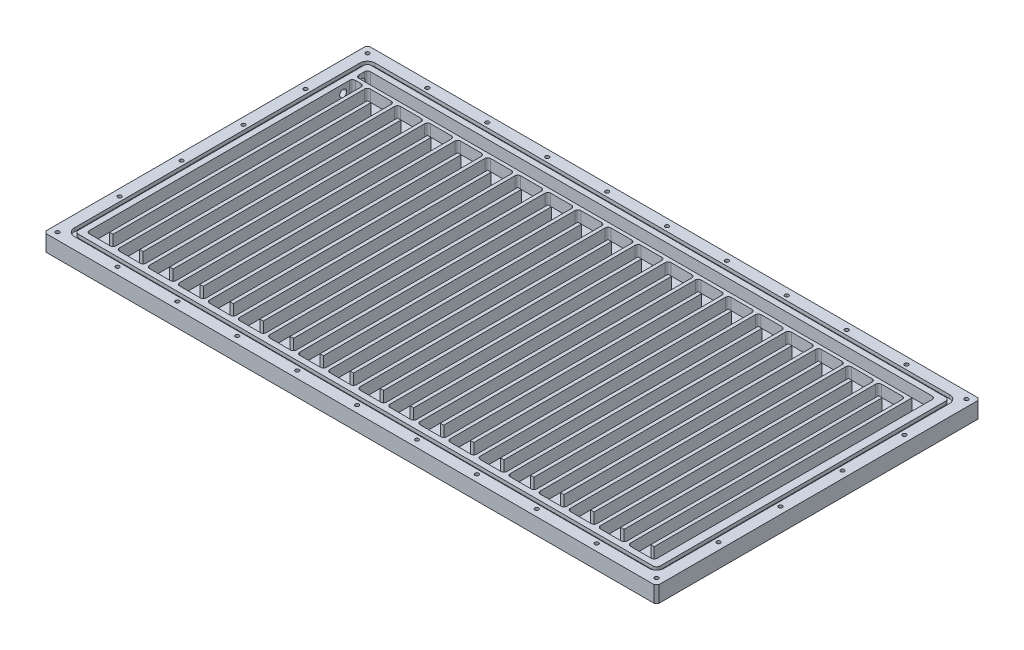
from build123d import *

# Parameters (mm, degrees)
SKETCH1_W             = 265
SKETCH1_H             = 140
BOSS_EXTRUDE1_DEPTH   = 14
CUT_EXTRUDE1_DEPTH    = 3
FILLET1_R             = 3
FILLET2_R             = 6.5
M4X0_7_TAPPED_HOLE1_D = 3.3
MIRROR4_COPY_1_D      = 3.3
SKETCH3_W             = 10
SKETCH3_H             = 230
CUT_EXTRUDE2_DEPTH    = 10
LPATTERN1_COUNT       = 38
LPATTERN1_PITCH       = 13
SKETCH4_W             = 3
SKETCH4_H             = 10
CUT_EXTRUDE3_DEPTH    = 10
LPATTERN2_COUNT       = 19
LPATTERN2_PITCH       = 26
SKETCH5_W             = 3
SKETCH5_H             = 10
CUT_EXTRUDE4_DEPTH    = 10
LPATTERN3_COUNT       = 18
LPATTERN3_PITCH       = 26
CUT_EXTRUDE5_DEPTH    = 10
FILLET3_R             = 2.5
FILLET4_R             = 2.5
CHAMFER1_SIZE         = 2
FILLET5_R             = 2.5
LPATTERN10_COUNT      = 2
LPATTERN10_PITCH      = 16


with BuildPart() as part:
    # Sketch1 → Boss-Extrude1 (new body)
    with BuildSketch(Plane(origin=(0, 0, 0), x_dir=(1, 0, 0), z_dir=(0, 1, 0))):
        with Locations((132.5, 70)):
            Rectangle(SKETCH1_W, SKETCH1_H)
    extrude(amount=BOSS_EXTRUDE1_DEPTH)

    # Sketch2 → Cut-Extrude1 (cut)
    with BuildSketch(Plane(origin=(0, 14, 0), x_dir=(1, 0, 0), z_dir=(0, 1, 0))):
        Polygon((10, 140), (13.5, 140), (13.5, 13.5), (265, 13.5), (265, 10), (14.894895508, 10), (10, 10), align=None)
    extrude(amount=-CUT_EXTRUDE1_DEPTH, mode=Mode.SUBTRACT)

    # Fillet1
    fillet1_edges = [part.edges().sort_by_distance(p)[0] for p in [
        (13.5, 12.5, -13.5),
    ]]
    fillet(fillet1_edges, radius=FILLET1_R)

    # Fillet2
    fillet2_edges = [part.edges().sort_by_distance(p)[0] for p in [
        (10, 12.5, -10),
    ]]
    fillet(fillet2_edges, radius=FILLET2_R)

    # Mirror1: part across plane


with BuildPart() as part_1:
    add(part.part)
    add(part.part.mirror(Plane(origin=(265, 14, 0), x_dir=(0, 0, 1), z_dir=(-1, 0, 0))))

    # Mirror2: part across plane


with BuildPart() as part_2:
    add(part_1.part)
    add(part_1.part.mirror(Plane(origin=(0, 14, -140), x_dir=(1, 0, 0), z_dir=(0, 0, 1))))

    # M4x0.7 Tapped Hole1 (through all)
    with Locations(Plane(origin=(6, 0, -113.2), x_dir=(0, 0, -1), z_dir=(0, -1, 0))):
        with Locations((0, 0), (-53.6, 0), (-107.2, 0), (-107.2, 51.8), (-107.2, 103.6), (-107.2, 155.4), (-107.2, 207.2), (-107.2, 259)):
            m4x0_7_tapped_hole1 = Hole(M4X0_7_TAPPED_HOLE1_D / 2)

    # Mirror3: M4x0.7 Tapped Hole1 across plane
    add(m4x0_7_tapped_hole1.mirror(Plane.XY.offset(-140)), mode=Mode.SUBTRACT)

    # Mirror4: M4x0.7 Tapped Hole1 across plane
    add(m4x0_7_tapped_hole1.mirror(Plane(origin=(265, 0, 0), x_dir=(0, 0, 1), z_dir=(1, 0, 0))), mode=Mode.SUBTRACT)

    # Mirror4 copy 1 (through all)
    with Locations(Plane(origin=(524, 0, -166.8), x_dir=(0, 0, 1), z_dir=(0, -1, 0))):
        with Locations((0, 0), (-53.6, 0), (-107.2, 0), (-107.2, 51.8), (-107.2, 103.6), (-107.2, 155.4), (-107.2, 207.2), (-107.2, 259)):
            Hole(MIRROR4_COPY_1_D / 2)

    # Sketch3 → Cut-Extrude2 (cut)
    with BuildSketch(Plane(origin=(0, 14, 0), x_dir=(1, 0, 0), z_dir=(0, 1, 0))):
        with Locations((23.5, 133.5)):
            Rectangle(SKETCH3_W, SKETCH3_H)
    cut_extrude2 = extrude(amount=-CUT_EXTRUDE2_DEPTH, mode=Mode.SUBTRACT)

    # LPattern1: Cut-Extrude2 ×38
    with Locations(*[(i * LPATTERN1_PITCH, 0, 0) for i in range(1, LPATTERN1_COUNT)]):
        add(cut_extrude2, mode=Mode.SUBTRACT)

    # Sketch4 → Cut-Extrude3 (cut)
    with BuildSketch(Plane(origin=(0, 14, 0), x_dir=(1, 0, 0), z_dir=(0, 1, 0))):
        with Locations((30, 23.5)):
            Rectangle(SKETCH4_W, SKETCH4_H)
    cut_extrude3 = extrude(amount=-CUT_EXTRUDE3_DEPTH, mode=Mode.SUBTRACT)

    # LPattern2: Cut-Extrude3 ×19
    with Locations(*[(i * LPATTERN2_PITCH, 0, 0) for i in range(1, LPATTERN2_COUNT)]):
        add(cut_extrude3, mode=Mode.SUBTRACT)

    # Sketch5 → Cut-Extrude4 (cut)
    with BuildSketch(Plane(origin=(0, 14, 0), x_dir=(1, 0, 0), z_dir=(0, 1, 0))):
        with Locations((43, 243.5)):
            Rectangle(SKETCH5_W, SKETCH5_H)
    cut_extrude4 = extrude(amount=-CUT_EXTRUDE4_DEPTH, mode=Mode.SUBTRACT)

    # LPattern3: Cut-Extrude4 ×18
    with Locations(*[(i * LPATTERN3_PITCH, 0, 0) for i in range(1, LPATTERN3_COUNT)]):
        add(cut_extrude4, mode=Mode.SUBTRACT)

    # Sketch6 → Cut-Extrude5 (cut)
    with BuildSketch(Plane(origin=(0, 14, 0), x_dir=(1, 0, 0), z_dir=(0, 1, 0))):
        Polygon((18.5, 261.5), (509.5, 261.5), (509.5, 248.5), (499.5, 248.5), (499.5, 251.5), (18.5, 251.5), align=None)
    extrude(amount=-CUT_EXTRUDE5_DEPTH, mode=Mode.SUBTRACT)

    # Fillet3
    fillet3_edges = [part_2.edges().sort_by_distance(p)[0] for p in [
        (509.5, 9, -261.5),
        (18.5, 9, -18.5),
        (28.5, 9, -248.5),
        (31.5, 9, -248.5),
        (41.5, 9, -18.5),
        (44.5, 9, -18.5),
        (54.5, 9, -248.5),
        (57.5, 9, -248.5),
        (67.5, 9, -18.5),
        (70.5, 9, -18.5),
        (80.5, 9, -248.5),
        (83.5, 9, -248.5),
        (93.5, 9, -18.5),
        (96.5, 9, -18.5),
        (106.5, 9, -248.5),
        (109.5, 9, -248.5),
        (119.5, 9, -18.5),
        (122.5, 9, -18.5),
        (132.5, 9, -248.5),
        (135.5, 9, -248.5),
        (145.5, 9, -18.5),
        (148.5, 9, -18.5),
        (158.5, 9, -248.5),
        (161.5, 9, -248.5),
        (171.5, 9, -18.5),
        (174.5, 9, -18.5),
        (184.5, 9, -248.5),
        (187.5, 9, -248.5),
        (197.5, 9, -18.5),
        (200.5, 9, -18.5),
        (210.5, 9, -248.5),
        (213.5, 9, -248.5),
        (223.5, 9, -18.5),
        (226.5, 9, -18.5),
        (236.5, 9, -248.5),
        (239.5, 9, -248.5),
        (249.5, 9, -18.5),
        (252.5, 9, -18.5),
        (262.5, 9, -248.5),
        (265.5, 9, -248.5),
        (275.5, 9, -18.5),
        (278.5, 9, -18.5),
        (288.5, 9, -248.5),
        (291.5, 9, -248.5),
        (301.5, 9, -18.5),
        (304.5, 9, -18.5),
        (314.5, 9, -248.5),
        (317.5, 9, -248.5),
        (327.5, 9, -18.5),
        (330.5, 9, -18.5),
        (340.5, 9, -248.5),
        (343.5, 9, -248.5),
        (353.5, 9, -18.5),
        (356.5, 9, -18.5),
        (366.5, 9, -248.5),
        (369.5, 9, -248.5),
        (379.5, 9, -18.5),
        (382.5, 9, -18.5),
        (392.5, 9, -248.5),
        (395.5, 9, -248.5),
        (405.5, 9, -18.5),
        (408.5, 9, -18.5),
        (418.5, 9, -248.5),
        (421.5, 9, -248.5),
        (431.5, 9, -18.5),
        (434.5, 9, -18.5),
        (444.5, 9, -248.5),
        (447.5, 9, -248.5),
        (457.5, 9, -18.5),
        (460.5, 9, -18.5),
        (470.5, 9, -248.5),
        (473.5, 9, -248.5),
        (483.5, 9, -18.5),
        (486.5, 9, -18.5),
        (496.5, 9, -248.5),
        (509.5, 9, -18.5),
    ]]
    fillet(fillet3_edges, radius=FILLET3_R)

    # Fillet4
    fillet4_edges = [part_2.edges().sort_by_distance(p)[0] for p in [
        (18.5, 9, -248.5),
    ]]
    fillet(fillet4_edges, radius=FILLET4_R)

    # Chamfer1
    chamfer1_edges = [part_2.edges().sort_by_distance(p)[0] for p in [
        (530, 7, 0),
        (0, 7, 0),
        (0, 7, -280),
        (530, 7, -280),
    ]]
    chamfer(chamfer1_edges, length=CHAMFER1_SIZE)

    # Sketch8 → G1/8 Tapped Hole1 (revolve, cut)
    with BuildSketch(Plane(origin=(0, 7, -256.5), x_dir=(0, 0, 1), z_dir=(0, 1, 0))):
        Polygon((0, 0), (0, 11.363786724), (4.4, 8.72), (4.4, 0), align=None)
    g1_8_tapped_hole1 = revolve(axis=Axis((-6.35, 7, -256.5), (1, 0, 0)), mode=Mode.SUBTRACT)

    # Fillet5
    fillet5_edges = [part_2.edges().sort_by_distance(p)[0] for p in [
        (18.5, 9, -251.5),
        (18.5, 9, -261.5),
    ]]
    fillet(fillet5_edges, radius=FILLET5_R)

    # Sketch10 → Ø6.0 (6) Diameter Hole1 (revolve, cut)
    with BuildSketch(Plane(origin=(0, 7, -256.5), x_dir=(0, 0, 1), z_dir=(0, 1, 0))):
        Polygon((0, 0), (0, 23.802581857), (3, 22), (3, 0), align=None)
    f_6_0_6_diameter_hole1 = revolve(axis=Axis((-6.35, 7, -256.5), (1, 0, 0)), mode=Mode.SUBTRACT)

    # LPattern10: G1/8 Tapped Hole1, Ø6.0 (6) Diameter Hole1 ×2
    with Locations(*[(0, 0, i * LPATTERN10_PITCH) for i in range(1, LPATTERN10_COUNT)]):
        add(g1_8_tapped_hole1, mode=Mode.SUBTRACT)
        add(f_6_0_6_diameter_hole1, mode=Mode.SUBTRACT)


solid = part_2.part
